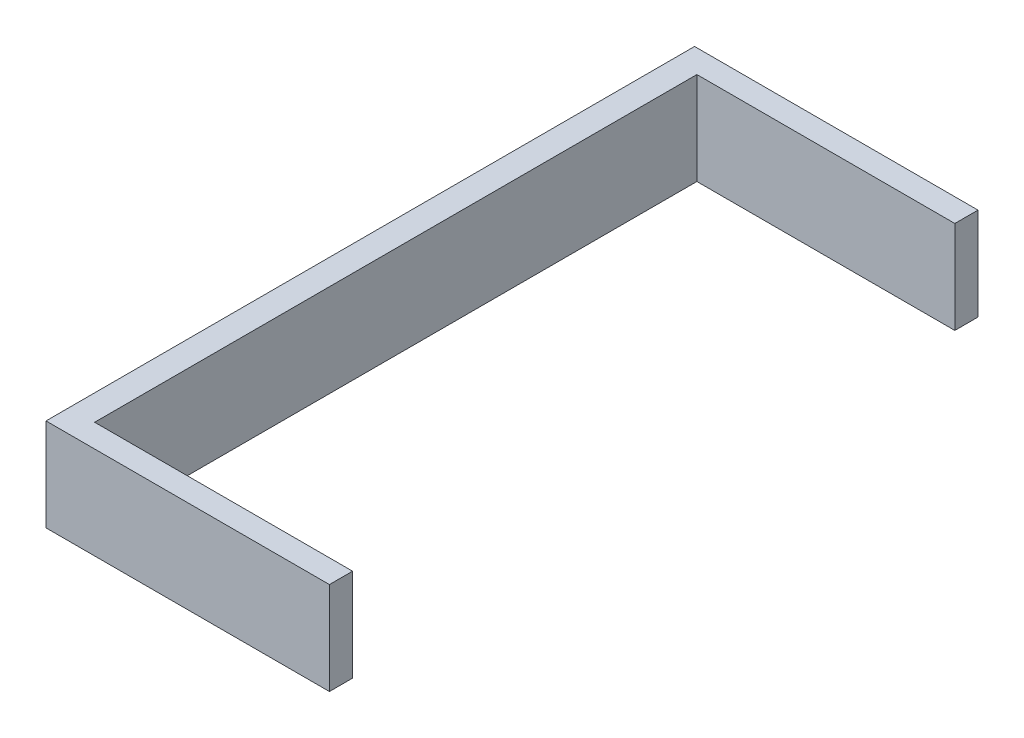
from build123d import *

# Parameters (mm, degrees)
EXTRUSION1_DEPTH = 25.4


with BuildPart() as part:
    # Sketch1 → Extrusion1 (new body)
    with BuildSketch(Plane(origin=(0, 0, 0), x_dir=(-1, 0, 0), z_dir=(0, 1, 0))):
        Polygon((-35.3568, 82.55), (35.3568, 82.55), (35.3568, -82.55), (-35.3568, -82.55), (-35.3568, -88.9), (42.3418, -88.9), (42.3418, 88.9), (-35.3568, 88.9), align=None)
    extrude(amount=EXTRUSION1_DEPTH)


solid = part.part
